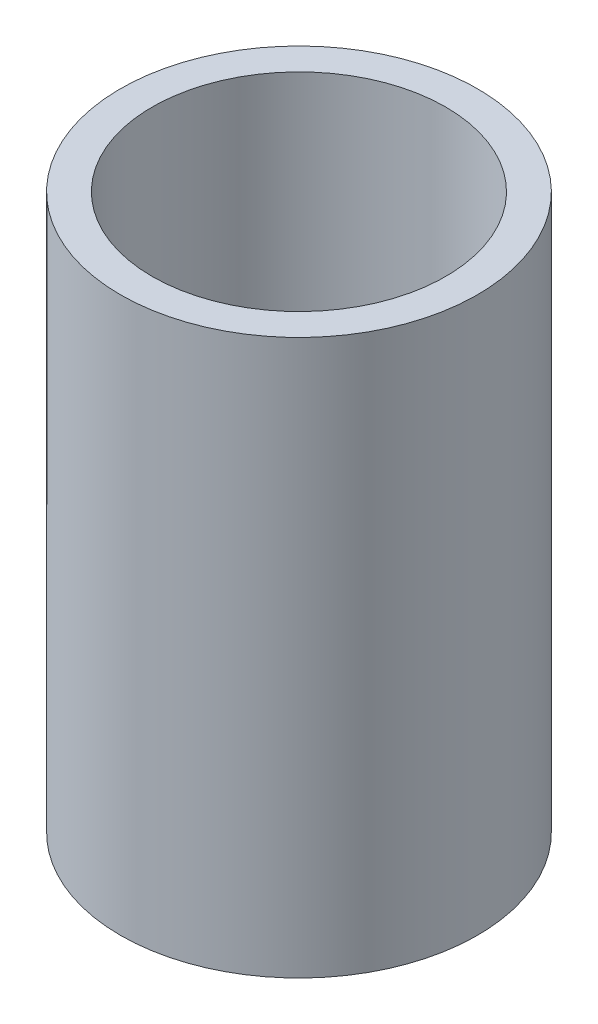
from build123d import *

# Parameters (mm, degrees)
SKETCH1_R           = 9.652
SKETCH1_R_2         = 7.9375
BOSS_EXTRUDE1_DEPTH = 30


with BuildPart() as part:
    # Sketch1 → Boss-Extrude1 (new body)
    with BuildSketch(Plane(origin=(0, 0, 0), x_dir=(1, 0, 0), z_dir=(0, 1, 0))):
        with Locations(Location((0, 0, 0), (0, 0, 270))):
            Circle(SKETCH1_R)
        with Locations(Location((0, 0, 0), (0, 0, 270))):
            Circle(SKETCH1_R_2, mode=Mode.SUBTRACT)
    extrude(amount=BOSS_EXTRUDE1_DEPTH)


solid = part.part
